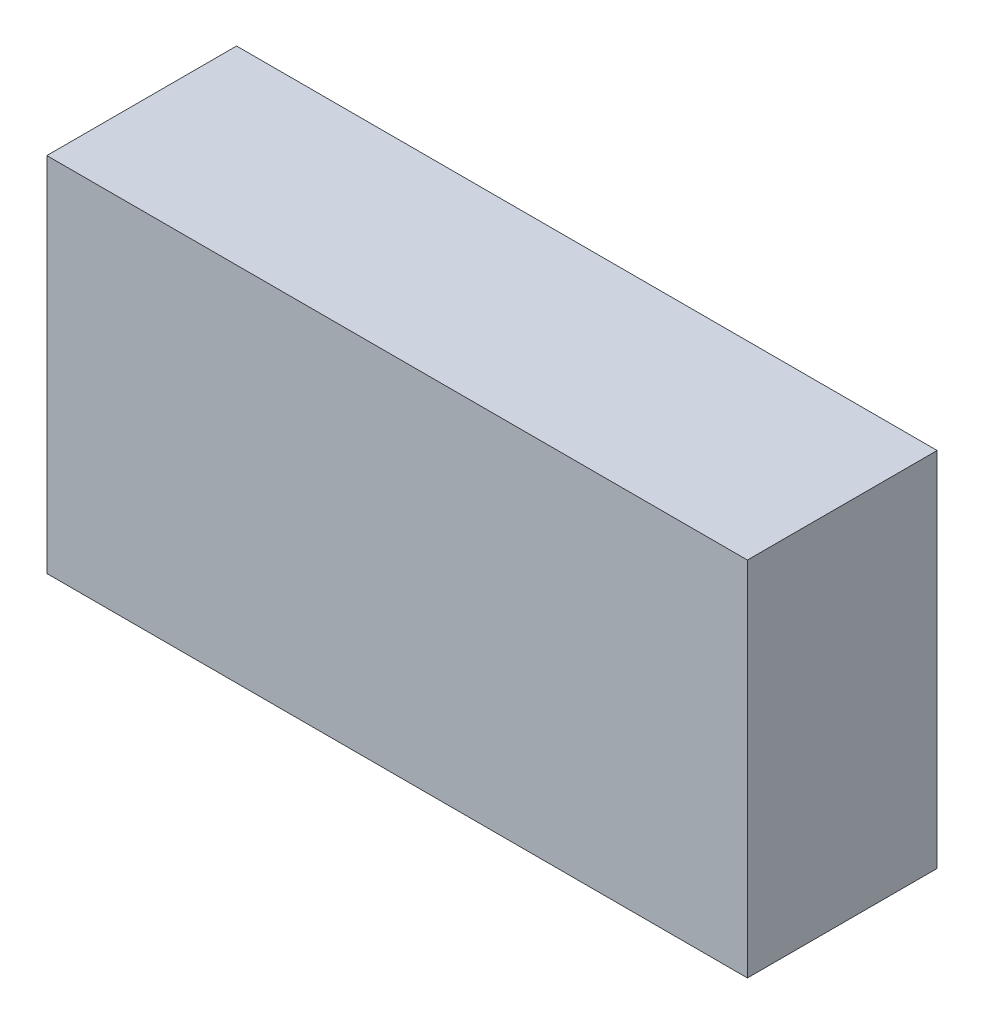
from build123d import *

# Parameters (mm, degrees)
SKETCH_1_W      = 240
SKETCH_1_H      = 124
EXTRUDE_1_DEPTH = 65


with BuildPart() as part:
    # 草图1 → 凸台-拉伸1 (new body)
    with BuildSketch(Plane.XY):
        with Locations((62.820512821, 13.512820513)):
            Rectangle(SKETCH_1_W, SKETCH_1_H)
    extrude(amount=EXTRUDE_1_DEPTH)


solid = part.part
